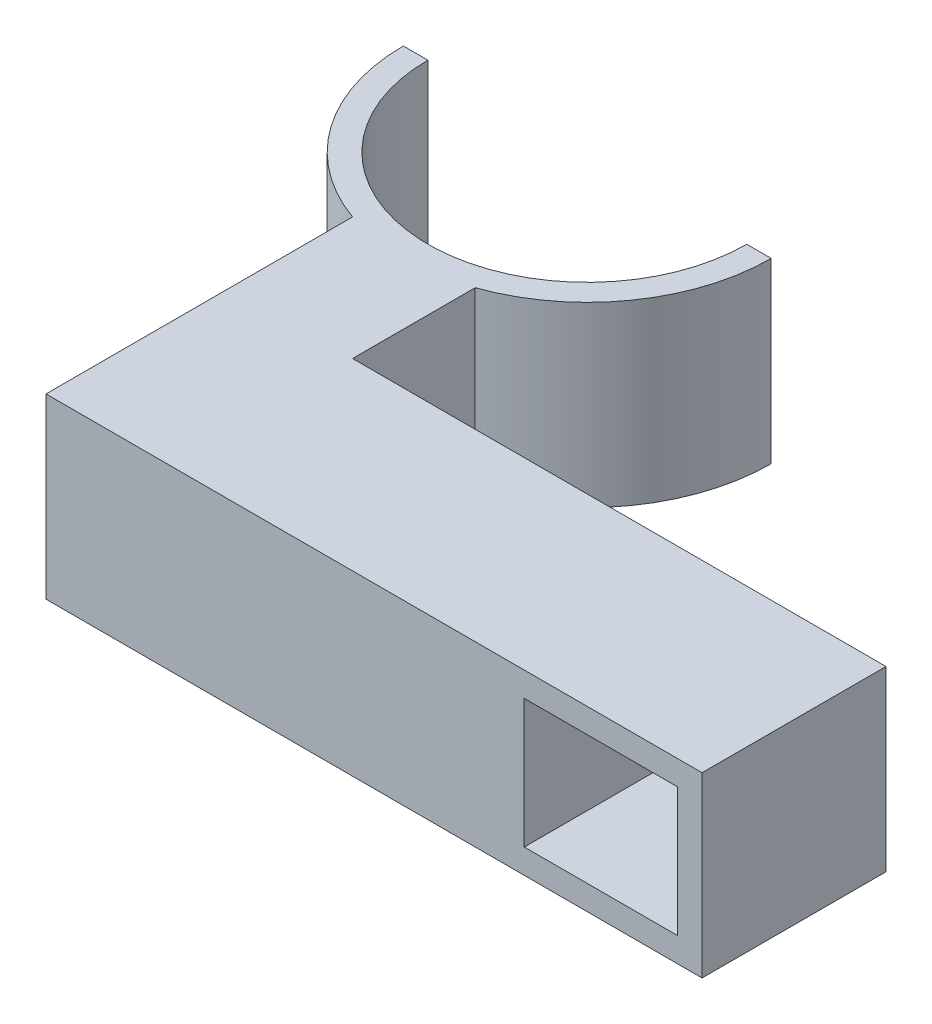
from build123d import *

# Parameters (mm, degrees)
SKETCH1_W           = 16.5
SKETCH1_H           = 14.5
SKETCH1_W_2         = 12.5
SKETCH1_H_2         = 10.5
BOSS_EXTRUDE1_DEPTH = 15
SKETCH2_W           = 15
SKETCH2_H           = 14.5
BOSS_EXTRUDE2_DEPTH = 37
SKETCH3_W           = 10
SKETCH3_H           = 14.5
BOSS_EXTRUDE3_DEPTH = 10
BOSS_EXTRUDE4_DEPTH = 14.5


with BuildPart() as part:
    # Sketch1 → Boss-Extrude1 (new body)
    with BuildSketch(Plane.XY):
        with Locations((6.25, -5.25)):
            Rectangle(SKETCH1_W, SKETCH1_H)
        with Locations((6.25, -5.25)):
            Rectangle(SKETCH1_W_2, SKETCH1_H_2, mode=Mode.SUBTRACT)
    extrude(amount=BOSS_EXTRUDE1_DEPTH)

    # Sketch2 → Boss-Extrude2 (add)
    with BuildSketch(Plane.ZY.offset(2)):
        with Locations((7.5, -5.25)):
            Rectangle(SKETCH2_W, SKETCH2_H)
    extrude(amount=BOSS_EXTRUDE2_DEPTH)

    # Sketch3 → Boss-Extrude3 (add)
    with BuildSketch(Plane(origin=(0, 0, 0), x_dir=(-1, 0, 0), z_dir=(0, 0, -1))):
        with Locations((34, -5.25)):
            Rectangle(SKETCH3_W, SKETCH3_H)
    extrude(amount=BOSS_EXTRUDE3_DEPTH)

    # Sketch4 → Boss-Extrude4 (add)
    with BuildSketch(Plane(origin=(0, 2, 0), x_dir=(1, 0, 0), z_dir=(0, 1, 0))):
        with BuildLine():
            Line((-19, 24.142135624), (-21, 24.142135624))
            ThreePointArc((-21, 24.142135624), (-34, 11.142135624), (-47, 24.142135624))
            Line((-47, 24.142135624), (-49, 24.142135624))
            ThreePointArc((-49, 24.142135624), (-34, 9.142135624), (-19, 24.142135624))
        make_face()
    extrude(amount=-BOSS_EXTRUDE4_DEPTH)


solid = part.part
